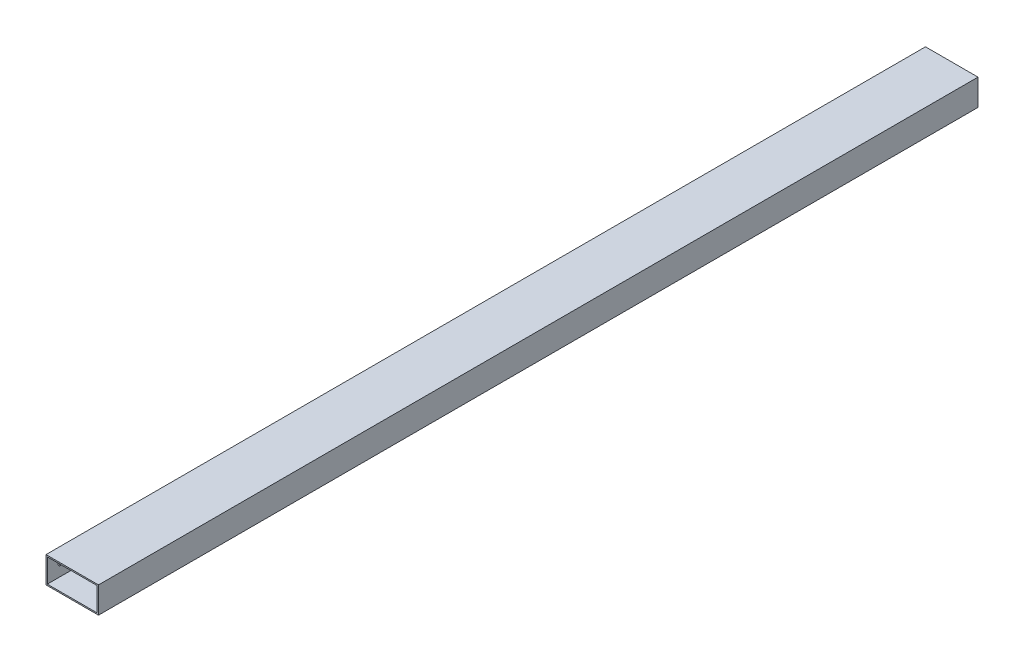
from build123d import *

# Parameters (mm, degrees)
SKETCH_1_W          = 40
SKETCH_1_H          = 20
SKETCH_1_W_2        = 38
SKETCH_1_H_2        = 18
EXTRUDE_1_DEPTH     = 670
SKETCH_4_R          = 1.75
CUT_EXTRUDE_2_DEPTH = 1.5
SKETCH_8_R          = 1.65
CUT_EXTRUDE_3_DEPTH = 5


with BuildPart() as part:
    # 草图1 → 拉伸-薄壁1 (new body)
    with BuildSketch(Plane.XY):
        with Locations((20, -10)):
            Rectangle(SKETCH_1_W, SKETCH_1_H)
        with Locations((20, -10)):
            Rectangle(SKETCH_1_W_2, SKETCH_1_H_2, mode=Mode.SUBTRACT)
    extrude(amount=EXTRUDE_1_DEPTH)

    # 草图4 → 切除-拉伸2 (cut)
    with BuildSketch(Plane.ZY):
        with Locations((659.996387591, -10)):
            Circle(SKETCH_4_R)
        with Locations((10, -10.000000002)):
            Circle(SKETCH_4_R)
    extrude(amount=-CUT_EXTRUDE_2_DEPTH, mode=Mode.SUBTRACT)

    # 草图8 → 切除-拉伸3 (cut)
    with BuildSketch(Plane.ZY):
        with Locations((100, -7.5)):
            Circle(SKETCH_8_R)
        with Locations((370, -7.5)):
            Circle(SKETCH_8_R)
    extrude(amount=-CUT_EXTRUDE_3_DEPTH, mode=Mode.SUBTRACT)


solid = part.part
